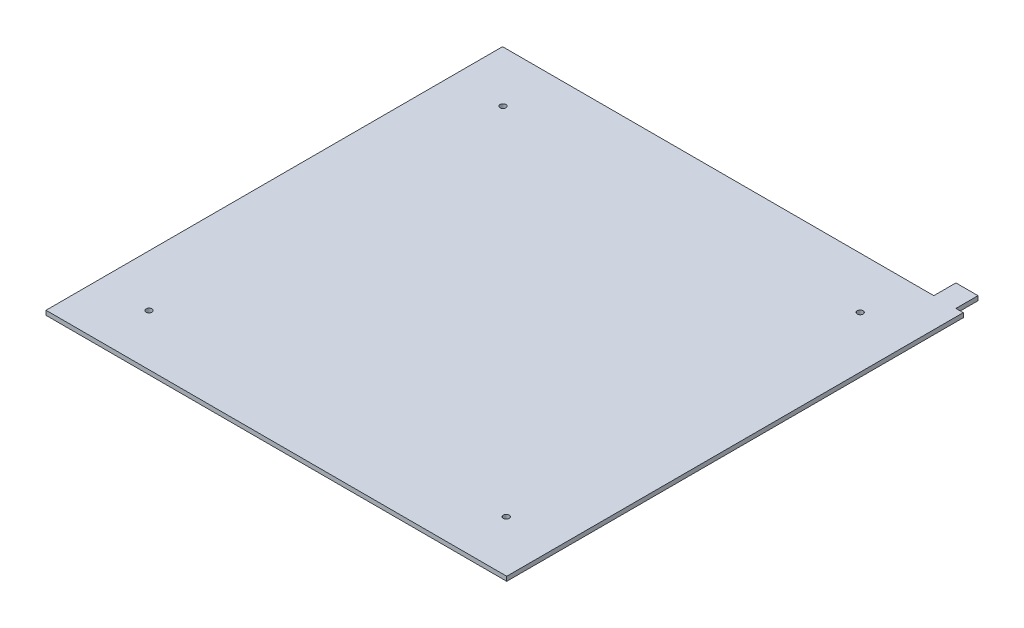
from build123d import *

# Parameters (mm, degrees)
SKETCH2_R           = 2
BOSS_EXTRUDE1_DEPTH = 3


with BuildPart() as part:
    # Sketch2 → Boss-Extrude1 (new body)
    with BuildSketch(Plane(origin=(0, 0, 0), x_dir=(1, 0, 0), z_dir=(0, 1, 0))):
        Polygon((-156.415, -155), (156.415, -155), (156.415, 155), (151.415, 155), (151.415, 170), (136.415, 170), (136.415, 155), (-156.415, 155), align=None)
        with Locations((-121.25633078, 120.159391816)):
            Circle(SKETCH2_R, mode=Mode.SUBTRACT)
        with Locations((-121.25633078, -120.159391816)):
            Circle(SKETCH2_R, mode=Mode.SUBTRACT)
        with Locations((121.25633078, -120.159391816)):
            Circle(SKETCH2_R, mode=Mode.SUBTRACT)
        with Locations((121.25633078, 120.159391816)):
            Circle(SKETCH2_R, mode=Mode.SUBTRACT)
    extrude(amount=BOSS_EXTRUDE1_DEPTH)


solid = part.part
